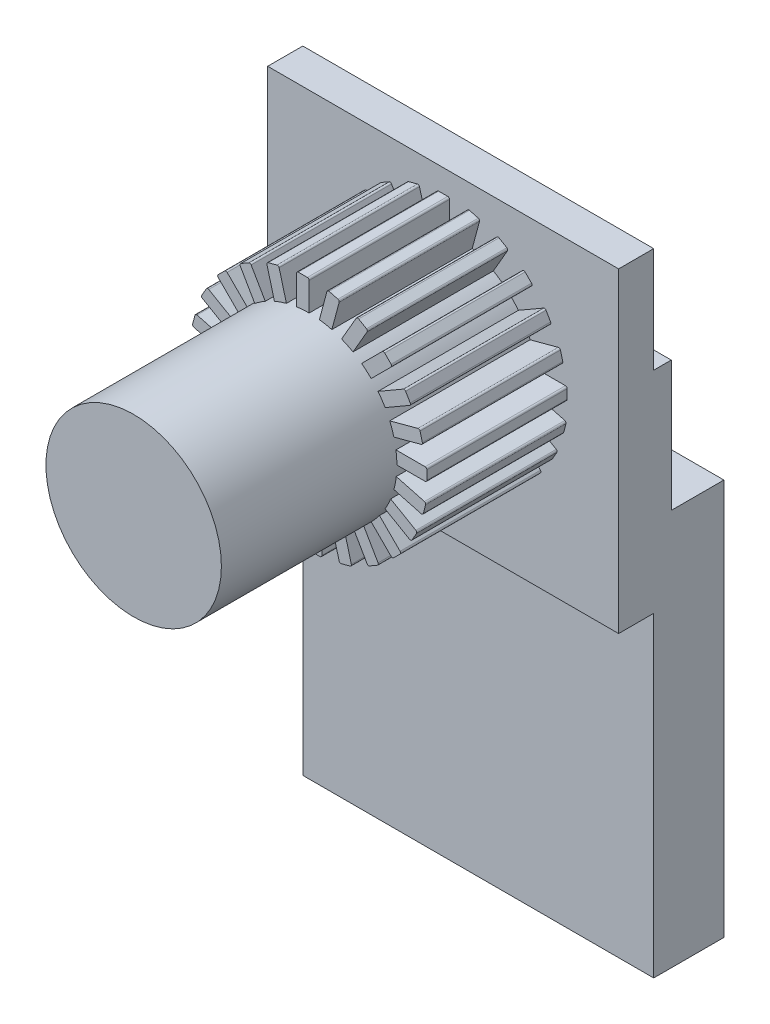
from build123d import *

# Parameters (mm, degrees)
BOSS_EXTRUDE1_DEPTH = 40
CUT_EXTRUDE2_DEPTH  = 30
SKETCH3_W           = 200
SKETCH3_H           = 180
BOSS_EXTRUDE2_DEPTH = 20
SKETCH5_R           = 7.547245139
CUT_EXTRUDE5_DEPTH  = 40
SKETCH6_R           = 50
BOSS_EXTRUDE3_DEPTH = 80
BOSS_EXTRUDE5_DEPTH = 80
CIRPATTERN1_COUNT   = 24
BOSS_EXTRUDE6_START = -100
SKETCH11_R          = 50
BOSS_EXTRUDE6_DEPTH = 100


with BuildPart() as part:
    # Sketch1 → Boss-Extrude1 (new body)
    with BuildSketch(Plane.XY):
        Polygon((24.052287582, 133.333333333), (4.052287582, 133.333333333), (-1.176470588, 69.281045752), (-85.947712418, 69.281045752), (-85.947712418, -166.666666667), (114.052287582, -166.666666667), (114.052287582, 69.281045752), (31.895424837, 69.281045752), align=None)
        Polygon((-1.176470588, 69.281045752), (4.052287582, 133.333333333), (-85.947712418, 133.333333333), (-85.947712418, 69.281045752), align=None)
        Polygon((114.052287582, 133.333333333), (24.052287582, 133.333333333), (31.895424837, 69.281045752), (114.052287582, 69.281045752), align=None)
    extrude(amount=BOSS_EXTRUDE1_DEPTH)

    # Sketch2 → Cut-Extrude2 (cut)
    with BuildSketch(Plane(origin=(0, 0, 0), x_dir=(-1, 0, 0), z_dir=(0, 0, -1))):
        Polygon((-24.052287582, 133.333333333), (-39.843372956, 59.123272647), (-114.052287582, 59.123272647), (-114.052287582, 133.333333333), align=None)
        Polygon((-4.052287582, 133.333333333), (7.844139299, 59.123272647), (85.947712418, 59.123272647), (85.947712418, 133.333333333), align=None)
    extrude(amount=-CUT_EXTRUDE2_DEPTH, mode=Mode.SUBTRACT)

    # Sketch3 → Boss-Extrude2 (add)
    with BuildSketch(Plane.XY.offset(40)):
        with Locations((14.052287582, 103.333333333)):
            Rectangle(SKETCH3_W, SKETCH3_H)
    extrude(amount=BOSS_EXTRUDE2_DEPTH)

    # Sketch5 → Cut-Extrude5 (cut, along a direction that is not the sketch's normal)
    with BuildSketch(Plane(origin=(-16.888044261, 2.707279604, 0), x_dir=(0, 0, 1), z_dir=(-0.9873932254298758, 0.1582865072429943, 0))):
        with Locations((18.477708868, 99.208462924)):
            Circle(SKETCH5_R)
    extrude(amount=-CUT_EXTRUDE5_DEPTH, dir=(-1, 0, 0), mode=Mode.SUBTRACT)

    # Sketch6 → Boss-Extrude3 (add)
    with BuildSketch(Plane.XY.offset(60)):
        with Locations((17.6708866, 113.333333333)):
            Circle(SKETCH6_R)
    extrude(amount=BOSS_EXTRUDE3_DEPTH)

    # Sketch7 → Boss-Extrude5 (add)
    with BuildSketch(Plane.XY.offset(140)):
        with BuildLine():
            Line((10.468100417, 162.811812202), (17.6708866, 162.811812202))
            Line((17.6708866, 162.811812202), (17.6708866, 179.42441274))
            ThreePointArc((17.6708866, 179.42441274), (17.377993381, 180.131519521), (16.6708866, 180.42441274))
            Line((16.6708866, 180.42441274), (11.468100417, 180.42441274))
            ThreePointArc((11.468100417, 180.42441274), (10.760993636, 180.131519521), (10.468100417, 179.42441274))
            Line((10.468100417, 179.42441274), (10.468100417, 162.811812202))
        make_face()
    boss_extrude5 = extrude(amount=-BOSS_EXTRUDE5_DEPTH)

    # CirPattern1: Boss-Extrude5 ×24 about axis
    cirpattern1_axis = Axis((17.6708866, 113.333333333, 0), (0, 0, 1))
    for i in range(1, CIRPATTERN1_COUNT):
        add(boss_extrude5.rotate(cirpattern1_axis, i * 360 / CIRPATTERN1_COUNT))

    # Sketch11 → Boss-Extrude6 (add)
    with BuildSketch(Plane.XY.offset(240).offset(BOSS_EXTRUDE6_START)):
        with Locations((17.6708866, 113.333333333)):
            Circle(SKETCH11_R)
    extrude(amount=BOSS_EXTRUDE6_DEPTH)


solid = part.part
